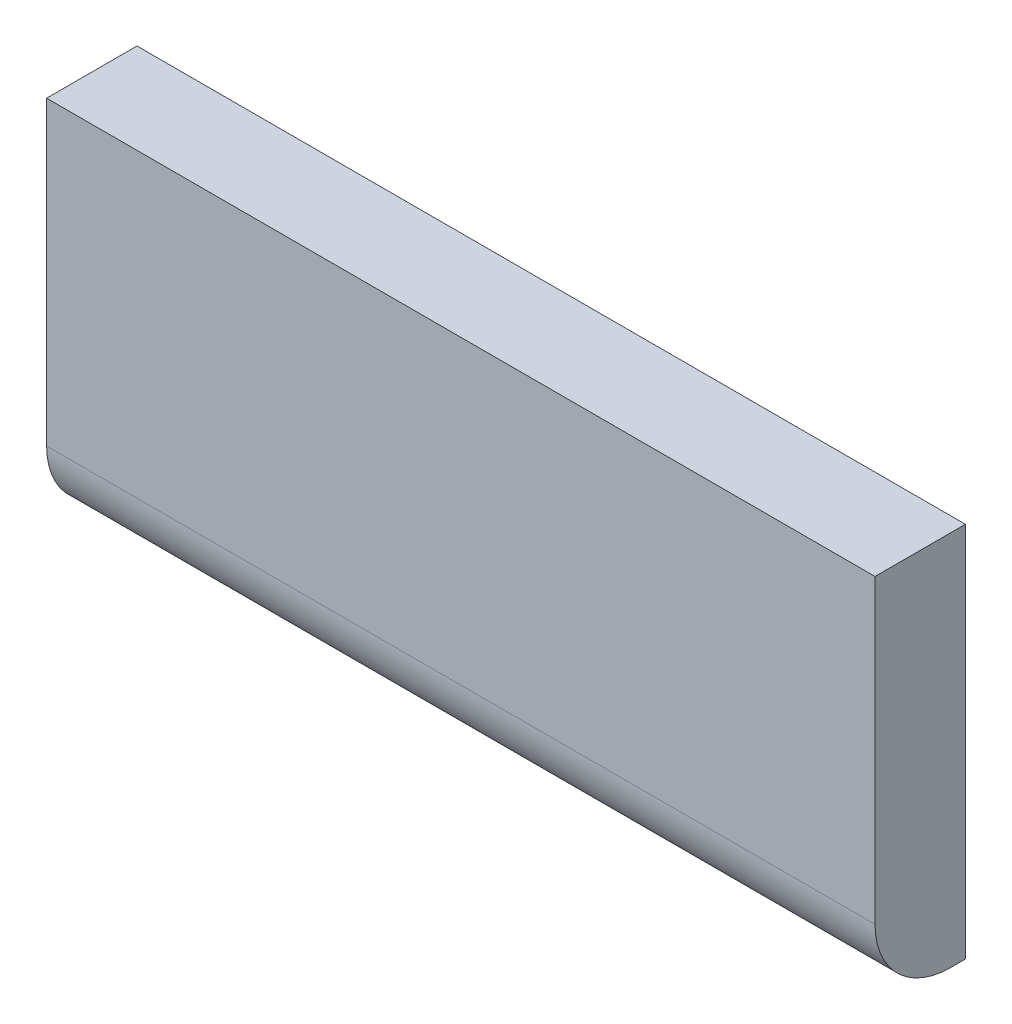
from build123d import *

# Parameters (mm, degrees)
SKETCH1_W           = 55
SKETCH1_H           = 25
BOSS_EXTRUDE1_DEPTH = 6
FILLET1_R           = 5


with BuildPart() as part:
    # Sketch1 → Boss-Extrude1 (new body)
    with BuildSketch(Plane.XY):
        Rectangle(SKETCH1_W, SKETCH1_H)
    extrude(amount=BOSS_EXTRUDE1_DEPTH)

    # Fillet1
    fillet1_edges = [part.edges().sort_by_distance(p)[0] for p in [
        (0, -12.5, 6),
    ]]
    fillet(fillet1_edges, radius=FILLET1_R)


solid = part.part
